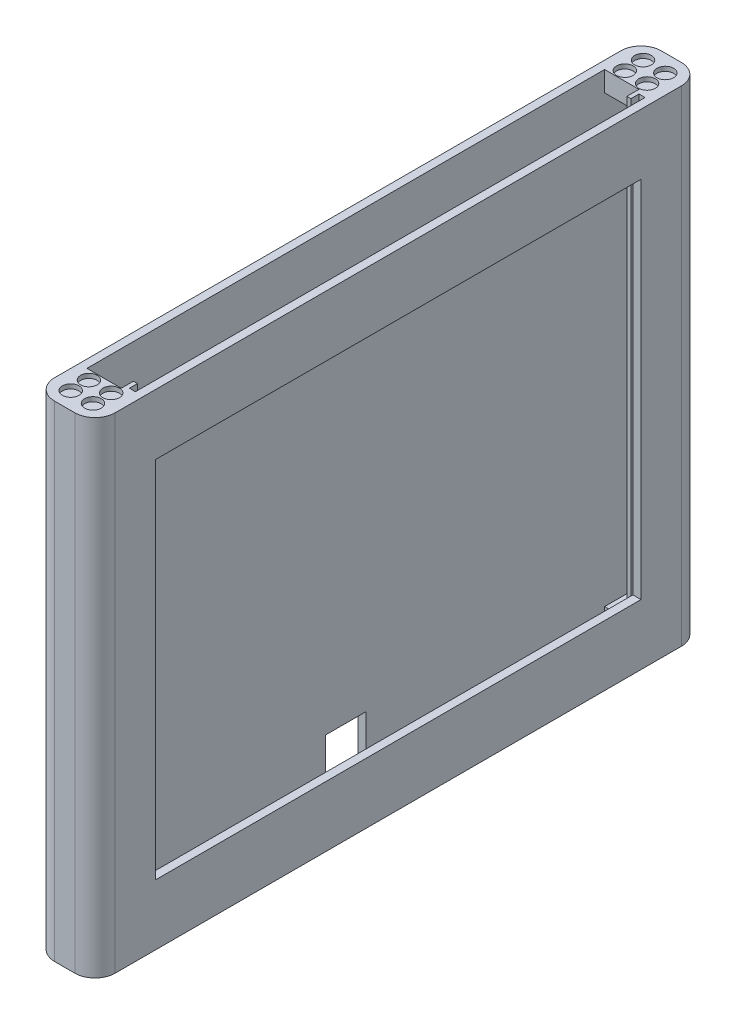
from build123d import *

# Parameters (mm, degrees)
SKETCH1_W               = 150
SKETCH1_H               = 120
BOSS_EXTRUDE1_DEPTH     = 15
SHELL1_T                = -2
CUT_EXTRUDE1_REACH      = 99.211
SKETCH2_W               = 120
SKETCH2_H               = 90
BOSS_EXTRUDE2_START     = -58
BOSS_EXTRUDE2_DEPTH     = 118
SKETCH4_W               = 13
SKETCH4_H               = 11
BOSS_EXTRUDE3_DEPTH     = 5
SKETCH5_R               = 2.05
CUT_EXTRUDE2_DEPTH      = 1.1
SKETCH6_W               = 10
SKETCH6_H               = 10
CUT_EXTRUDE3_DEPTH      = 2
MIRROR3_COPY_1_SKETCH_W = 13
MIRROR3_COPY_1_SKETCH_H = 11
MIRROR3_COPY_1_DEPTH    = 5
MIRROR3_COPY_2_SKETCH_R = 2.05
MIRROR3_COPY_2_DEPTH    = 1.1
FILLET1_R               = 5


with BuildPart() as part:
    # Sketch1 → Boss-Extrude1 (new body)
    with BuildSketch(Plane(origin=(0, 0, 0), x_dir=(0, 0, -1), z_dir=(1, 0, 0))):
        Rectangle(SKETCH1_W, SKETCH1_H)
    extrude(amount=-BOSS_EXTRUDE1_DEPTH)

    # Shell1
    shell1_openings = [part.faces().sort_by_distance(p)[0] for p in [
        (-7.5, 60, 0),
    ]]
    offset(amount=SHELL1_T, openings=shell1_openings, kind=Kind.INTERSECTION)

    # Sketch2 → Cut-Extrude1 (cut, up to next)
    with BuildSketch(Plane(origin=(0, 0, 0), x_dir=(0, 0, -1), z_dir=(1, 0, 0)), mode=Mode.PRIVATE) as cut_extrude1_sk1:
        Rectangle(SKETCH2_W, SKETCH2_H)
    cut_extrude1_tool1 = extrude(cut_extrude1_sk1.sketch, amount=-CUT_EXTRUDE1_REACH, mode=Mode.PRIVATE) & part.part
    add(cut_extrude1_tool1.solids().sort_by_distance((0, 0, 0))[0], mode=Mode.SUBTRACT)

    # Sketch3 → Boss-Extrude2 (add)
    with BuildSketch(Plane(origin=(0, 0, 0), x_dir=(1, 0, 0), z_dir=(0, 1, 0)).offset(BOSS_EXTRUDE2_START)):
        Polygon((-3.5, 63), (-2, 63), (-2, 64), (-4.5, 64), (-4.5, 61), (-3.5, 61), align=None)
    boss_extrude2 = extrude(amount=BOSS_EXTRUDE2_DEPTH)

    # Mirror1: Boss-Extrude2 across plane
    add(boss_extrude2.mirror(Plane.XY))

    # Sketch4 → Boss-Extrude3 (add)
    with BuildSketch(Plane(origin=(0, 60, 0), x_dir=(1, 0, 0), z_dir=(0, 1, 0))):
        with Locations((-8.5, 69.5)):
            Rectangle(SKETCH4_W, SKETCH4_H)
    boss_extrude3 = extrude(amount=-BOSS_EXTRUDE3_DEPTH)

    # Sketch5 → Cut-Extrude2 (cut)
    with BuildSketch(Plane(origin=(0, 60, 0), x_dir=(1, 0, 0), z_dir=(0, 1, 0))):
        with Locations(Location((-10.25, 70.75, 0), (0, 0, 270))):
            Circle(SKETCH5_R)
        with Locations(Location((-10.25, 66.25, 0), (0, 0, 270))):
            Circle(SKETCH5_R)
        with Locations(Location((-4.75, 70.75, 0), (0, 0, 270))):
            Circle(SKETCH5_R)
        with Locations(Location((-4.75, 66.25, 0), (0, 0, 270))):
            Circle(SKETCH5_R)
    cut_extrude2 = extrude(amount=-CUT_EXTRUDE2_DEPTH, mode=Mode.SUBTRACT)

    # Mirror2: Boss-Extrude3, Cut-Extrude2 across plane
    add(boss_extrude3.mirror(Plane.XY))
    add(cut_extrude2.mirror(Plane.XY), mode=Mode.SUBTRACT)

    # Sketch6 → Cut-Extrude3 (cut)
    with BuildSketch(Plane.ZY.offset(15)):
        with Locations((0, -53)):
            Rectangle(SKETCH6_W, SKETCH6_H)
    extrude(amount=-CUT_EXTRUDE3_DEPTH, mode=Mode.SUBTRACT)

    # Mirror3: Boss-Extrude3, Cut-Extrude2 across plane
    add(boss_extrude3.mirror(Plane.ZX))
    add(cut_extrude2.mirror(Plane.ZX), mode=Mode.SUBTRACT)

    # Mirror3 copy 1 sketch → Mirror3 copy 1 (add)
    with BuildSketch(Plane.XZ.offset(60)):
        with Locations((-8.5, 69.5)):
            Rectangle(MIRROR3_COPY_1_SKETCH_W, MIRROR3_COPY_1_SKETCH_H)
    extrude(amount=-MIRROR3_COPY_1_DEPTH)

    # Mirror3 copy 2 sketch → Mirror3 copy 2 (cut)
    with BuildSketch(Plane.XZ.offset(60)):
        with Locations(Location((-10.25, 70.75, 0), (0, 0, 270))):
            Circle(MIRROR3_COPY_2_SKETCH_R)
        with Locations(Location((-10.25, 66.25, 0), (0, 0, 270))):
            Circle(MIRROR3_COPY_2_SKETCH_R)
        with Locations(Location((-4.75, 70.75, 0), (0, 0, 270))):
            Circle(MIRROR3_COPY_2_SKETCH_R)
        with Locations(Location((-4.75, 66.25, 0), (0, 0, 270))):
            Circle(MIRROR3_COPY_2_SKETCH_R)
    extrude(amount=-MIRROR3_COPY_2_DEPTH, mode=Mode.SUBTRACT)

    # Fillet1
    fillet1_edges = [part.edges().sort_by_distance(p)[0] for p in [
        (-15, 0, 75),
        (-15, 0, -75),
        (0, 0, 75),
        (0, 0, -75),
    ]]
    fillet(fillet1_edges, radius=FILLET1_R)


solid = part.part
